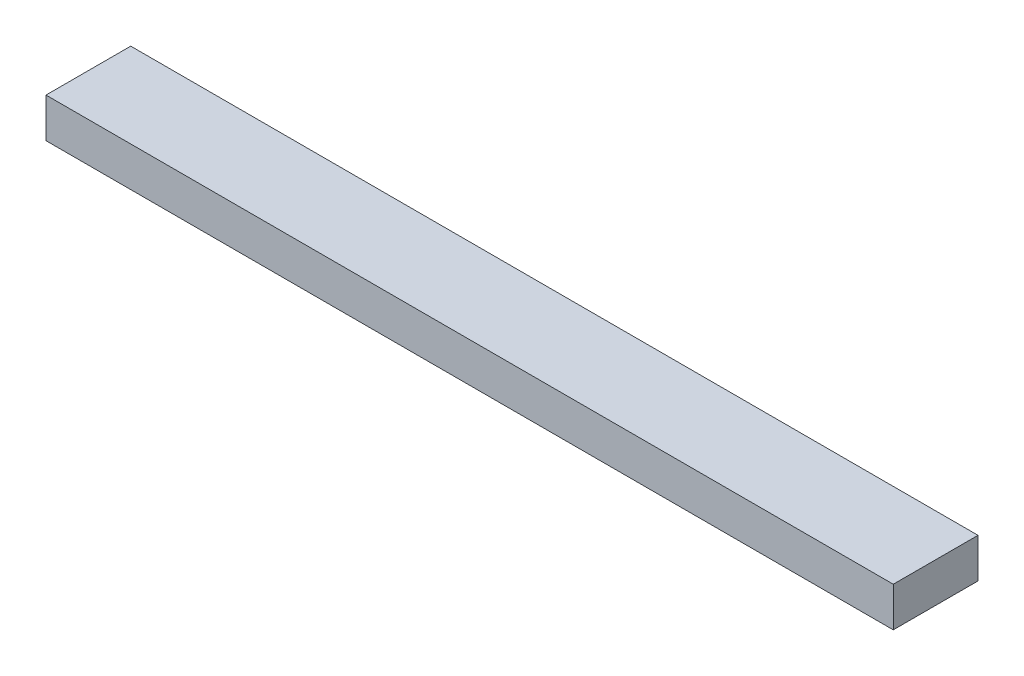
from build123d import *

# Parameters (mm, degrees)
SKETCH1_W           = 1500
SKETCH1_H           = 70
BOSS_EXTRUDE1_DEPTH = 150


with BuildPart() as part:
    # Sketch1 → Boss-Extrude1 (new body)
    with BuildSketch(Plane.XY):
        with Locations((0, -35)):
            Rectangle(SKETCH1_W, SKETCH1_H)
    extrude(amount=BOSS_EXTRUDE1_DEPTH)


solid = part.part
